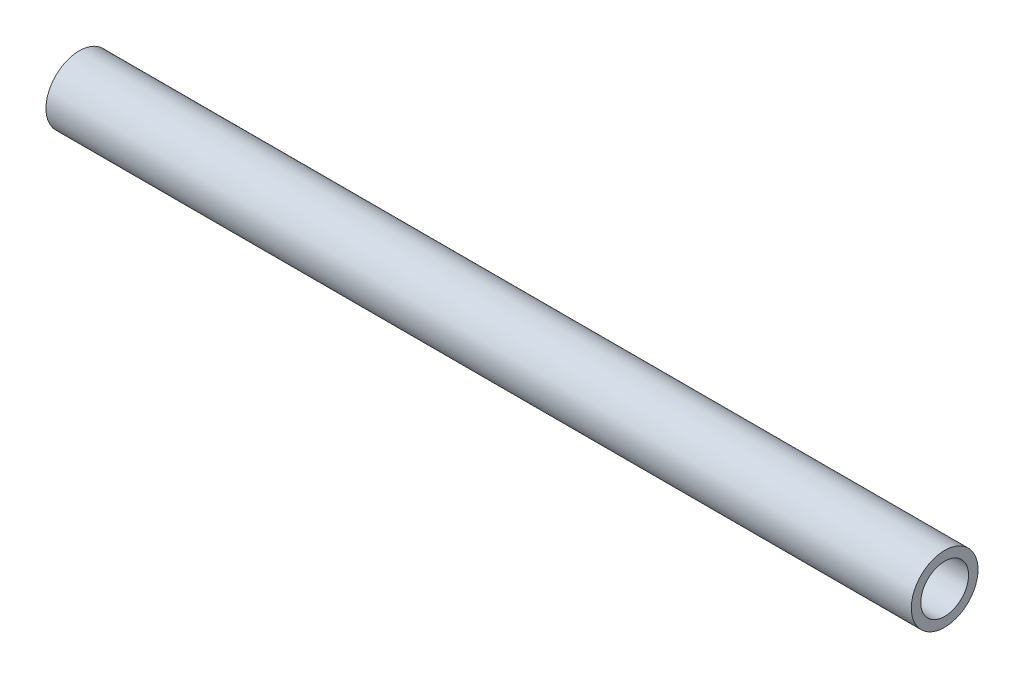
from build123d import *

# Parameters (mm, degrees)
SKETCH1_R           = 10.668
SKETCH1_R_2         = 7.6454
BOSS_EXTRUDE1_DEPTH = 132.08
SKETCH2_R           = 2.3876
CUT_EXTRUDE1_DEPTH  = 133.938853794
SKETCH3_R           = 10.668
SKETCH3_R_2         = 7.6454
BOSS_EXTRUDE2_DEPTH = 6.35


with BuildPart() as part:
    # Sketch1 → Boss-Extrude1 (new, symmetric)
    with BuildSketch(Plane(origin=(0, 0, 0), x_dir=(0, 0, -1), z_dir=(1, 0, 0))):
        Circle(SKETCH1_R)
        Circle(SKETCH1_R_2, mode=Mode.SUBTRACT)
    extrude(amount=BOSS_EXTRUDE1_DEPTH, both=True)

    # Sketch2 → Cut-Extrude1 (cut, through all)
    with BuildSketch(Plane(origin=(0, 0, 0), x_dir=(1, 0, 0), z_dir=(0, 1, 0))):
        with Locations(Location((121.92, 0, 0), (0, 0, 270))):
            Circle(SKETCH2_R)
        with Locations(Location((101.6, 0, 0), (0, 0, 270))):
            Circle(SKETCH2_R)
        with Locations(Location((81.28, 0, 0), (0, 0, 270))):
            Circle(SKETCH2_R)
        with Locations(Location((60.96, 0, 0), (0, 0, 270))):
            Circle(SKETCH2_R)
        with Locations(Location((40.64, 0, 0), (0, 0, 270))):
            Circle(SKETCH2_R)
        with Locations(Location((20.32, 0, 0), (0, 0, 270))):
            Circle(SKETCH2_R)
        with Locations(Location((0, 0, 0), (0, 0, 270))):
            Circle(SKETCH2_R)
        with Locations(Location((-20.32, 0, 0), (0, 0, 270))):
            Circle(SKETCH2_R)
        with Locations(Location((-40.64, 0, 0), (0, 0, 270))):
            Circle(SKETCH2_R)
        with Locations(Location((-60.96, 0, 0), (0, 0, 270))):
            Circle(SKETCH2_R)
        with Locations(Location((-81.28, 0, 0), (0, 0, 270))):
            Circle(SKETCH2_R)
        with Locations(Location((-101.6, 0, 0), (0, 0, 270))):
            Circle(SKETCH2_R)
        with Locations(Location((-121.92, 0, 0), (0, 0, 270))):
            Circle(SKETCH2_R)
    extrude(amount=-CUT_EXTRUDE1_DEPTH, mode=Mode.SUBTRACT)

    # Sketch3 → Boss-Extrude2 (add)
    with BuildSketch(Plane(origin=(132.08, 0, 0), x_dir=(0, 0, -1), z_dir=(1, 0, 0))):
        Circle(SKETCH3_R)
        Circle(SKETCH3_R_2, mode=Mode.SUBTRACT)
    boss_extrude2 = extrude(amount=BOSS_EXTRUDE2_DEPTH)

    # Mirror1: Boss-Extrude2 across plane
    add(boss_extrude2.mirror(Plane(origin=(0, 0, 0), x_dir=(0, 0, 1), z_dir=(1, 0, 0))))


solid = part.part
